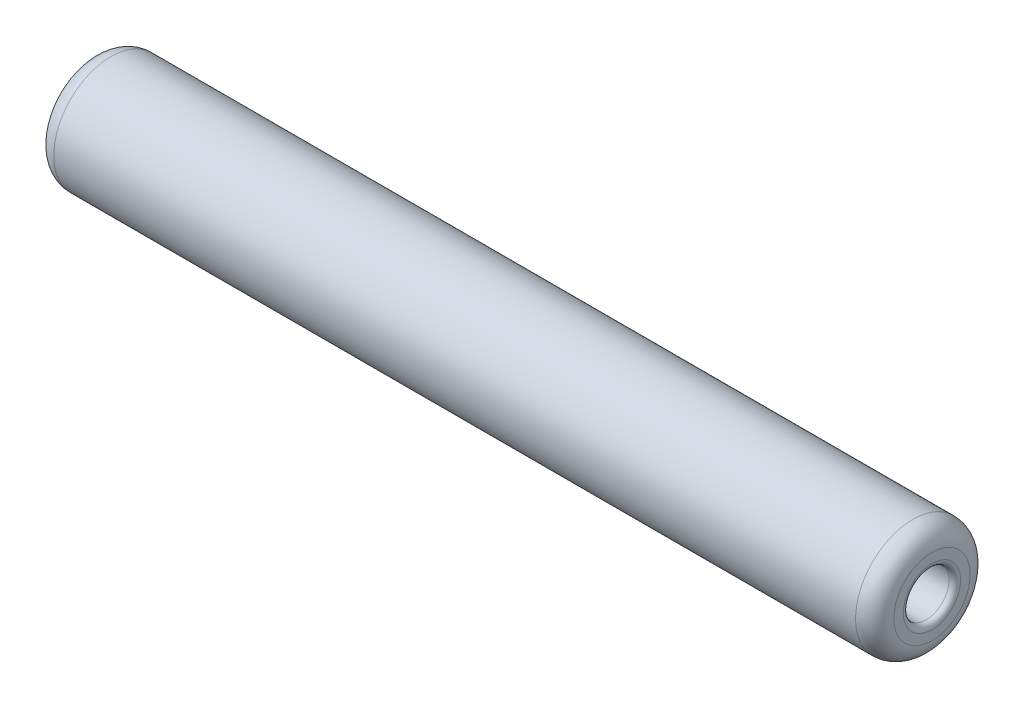
from build123d import *

# Parameters (mm, degrees)
SKETCH_1_R          = 3
EXTRUDE_1_DEPTH     = 44
SKETCH_2_R          = 1.2
CUT_EXTRUDE_1_DEPTH = 44
FILLET_1_R          = 1
FILLET_2_R          = 0.3


with BuildPart() as part:
    # 草图1 → 凸台-拉伸1 (new body)
    with BuildSketch(Plane(origin=(0, 0, 0), x_dir=(0, 0, -1), z_dir=(1, 0, 0))):
        Circle(SKETCH_1_R)
    extrude(amount=EXTRUDE_1_DEPTH)

    # 草图2 → 切除-拉伸1 (cut)
    with BuildSketch(Plane.ZY):
        Circle(SKETCH_2_R)
    extrude(amount=-CUT_EXTRUDE_1_DEPTH, mode=Mode.SUBTRACT)

    # 圆角1
    fillet_1_edges = [part.edges().sort_by_distance(p)[0] for p in [
        (0, 0, 3),
        (44, 0, 3),
    ]]
    fillet(fillet_1_edges, radius=FILLET_1_R)

    # 圆角2
    fillet_2_edges = [part.edges().sort_by_distance(p)[0] for p in [
        (44, 0, -1.2),
        (0, 0, -1.2),
    ]]
    fillet(fillet_2_edges, radius=FILLET_2_R)


solid = part.part
